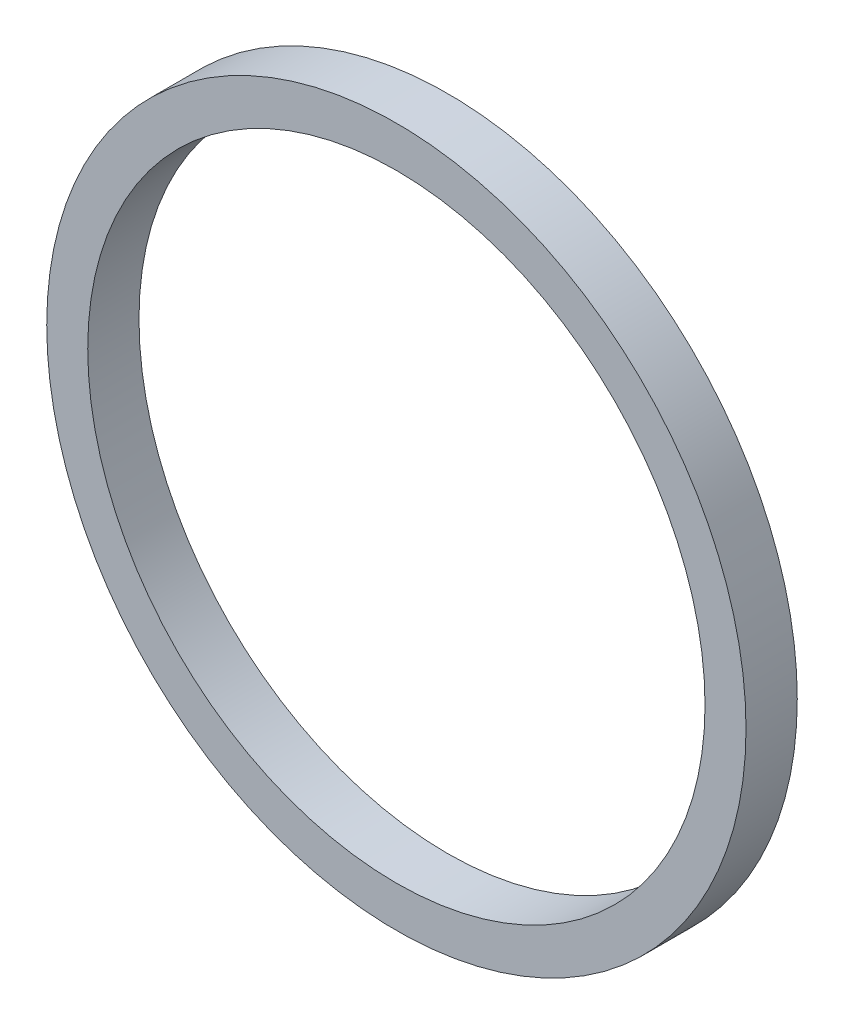
from build123d import *

# Parameters (mm, degrees)
SKETCH1_R                  = 17.0561
SKETCH1_R_2                = 15.0561
RECEPTACLE_LIGHTPIPE_DEPTH = 3
FACE_OFFSET_BY             = 0.5


with BuildPart() as part:
    # Sketch1 → Receptacle Lightpipe (new body)
    with BuildSketch(Plane.XY):
        Circle(SKETCH1_R)
        Circle(SKETCH1_R_2, mode=Mode.SUBTRACT)
    extrude(amount=-RECEPTACLE_LIGHTPIPE_DEPTH)

    # Face Offset: a face moved inward by 0.5
    extrude(part.faces().sort_by_distance((-8.52805, -13.64488, 0))[0], amount=FACE_OFFSET_BY, dir=(0, 0, -1), mode=Mode.SUBTRACT)


solid = part.part
